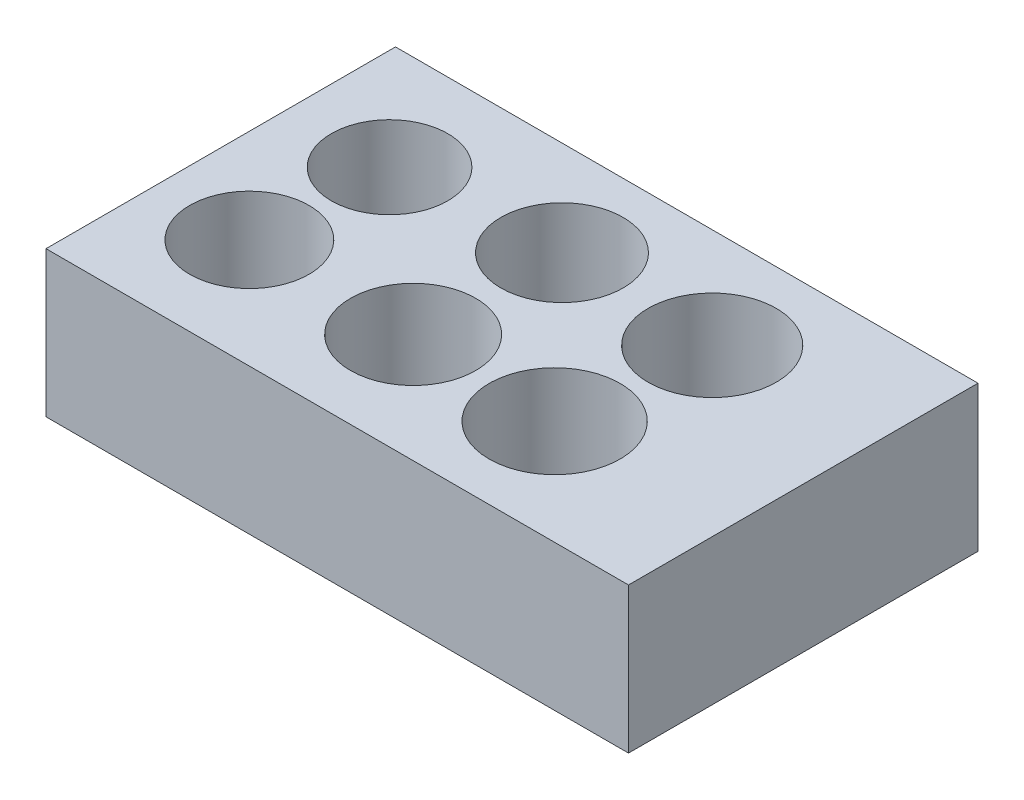
from build123d import *

# Parameters (mm, degrees)
SKETCH_1_W          = 20
SKETCH_1_H          = 12
EXTRUDE_1_DEPTH     = 5
SKETCH_2_R          = 2
SKETCH_2_R_2        = 2.05
SKETCH_2_R_3        = 2.1
SKETCH_2_R_4        = 2.15
SKETCH_2_R_5        = 2.2
SKETCH_2_R_6        = 2.25
CUT_EXTRUDE_1_DEPTH = 4


with BuildPart() as part:
    # 草图1 → 凸台-拉伸1 (new body)
    with BuildSketch(Plane(origin=(0, 0, 0), x_dir=(1, 0, 0), z_dir=(0, 1, 0))):
        with Locations((10, -6)):
            Rectangle(SKETCH_1_W, SKETCH_1_H)
    extrude(amount=EXTRUDE_1_DEPTH)

    # 草图2 → 切除-拉伸1 (cut)
    with BuildSketch(Plane(origin=(0, 5, 0), x_dir=(1, 0, 0), z_dir=(0, 1, 0))):
        with Locations(Location((3.476254808, -3.680242109, 0), (0, 0, 270))):
            Circle(SKETCH_2_R)
        with Locations(Location((3.229599534, -8.247035795, 0), (0, 0, 270))):
            Circle(SKETCH_2_R_2)
        with Locations(Location((8.978134133, -3.261157426, 0), (0, 0, 270))):
            Circle(SKETCH_2_R_3)
        with Locations(Location((8.852635447, -8.247035795, 0), (0, 0, 270))):
            Circle(SKETCH_2_R_4)
        with Locations(Location((14.310377601, -3.437086278, 0), (0, 0, 270))):
            Circle(SKETCH_2_R_5)
        with Locations(Location((13.863696284, -8.399377426, 0), (0, 0, 270))):
            Circle(SKETCH_2_R_6)
    extrude(amount=-CUT_EXTRUDE_1_DEPTH, mode=Mode.SUBTRACT)


solid = part.part
